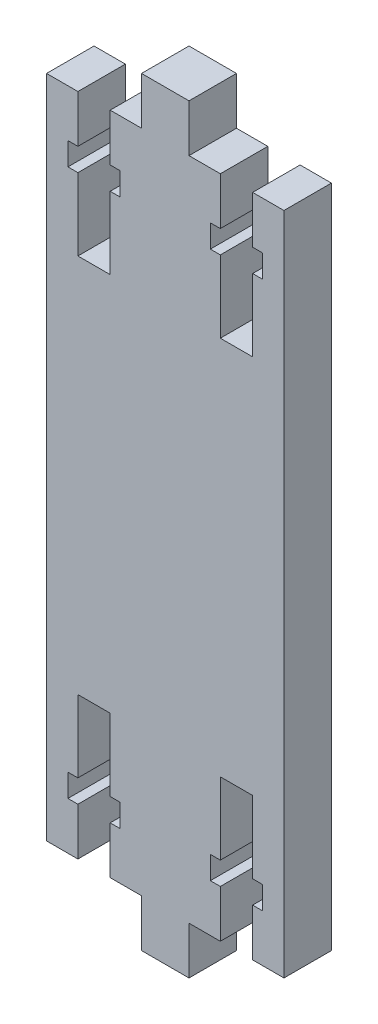
from build123d import *

# Parameters (mm, degrees)
BOSS_EXTRUDE1_DEPTH = 5
CUT_EXTRUDE1_DEPTH  = 10


with BuildPart() as part:
    # Sketch1 → Boss-Extrude1 (new body)
    with BuildSketch(Plane.XY):
        Polygon((-12.5, 35), (-12.5, -35), (-2.5, -35), (-2.5, -40), (2.5, -40), (2.5, -35), (12.5, -35), (12.5, 35), (2.5, 35), (2.5, 40), (-2.5, 40), (-2.5, 35), align=None)
    extrude(amount=BOSS_EXTRUDE1_DEPTH)

    # Sketch2 → Cut-Extrude1 (cut)
    with BuildSketch(Plane(origin=(0, 0, 0), x_dir=(-1, 0, 0), z_dir=(0, 0, -1))):
        Polygon((5.8, 35), (9.2, 35), (9.2, 30), (10.25, 30), (10.25, 27.6), (9.2, 27.6), (9.2, 20), (5.8, 20), (5.8, 27.6), (4.75, 27.6), (4.75, 30), (5.8, 30), align=None)
        Polygon((-5.8, 35), (-5.8, 30), (-4.75, 30), (-4.75, 27.6), (-5.8, 27.6), (-5.8, 20), (-9.2, 20), (-9.2, 27.6), (-10.25, 27.6), (-10.25, 30), (-9.2, 30), (-9.2, 35), align=None)
        Polygon((-5.8, -35), (-9.2, -35), (-9.2, -30), (-10.25, -30), (-10.25, -27.6), (-9.2, -27.6), (-9.2, -20), (-5.8, -20), (-5.8, -27.6), (-4.75, -27.6), (-4.75, -30), (-5.8, -30), align=None)
        Polygon((5.8, -35), (5.8, -30), (4.75, -30), (4.75, -27.6), (5.8, -27.6), (5.8, -20), (9.2, -20), (9.2, -27.6), (10.25, -27.6), (10.25, -30), (9.2, -30), (9.2, -35), align=None)
    extrude(amount=-CUT_EXTRUDE1_DEPTH, mode=Mode.SUBTRACT)


solid = part.part
